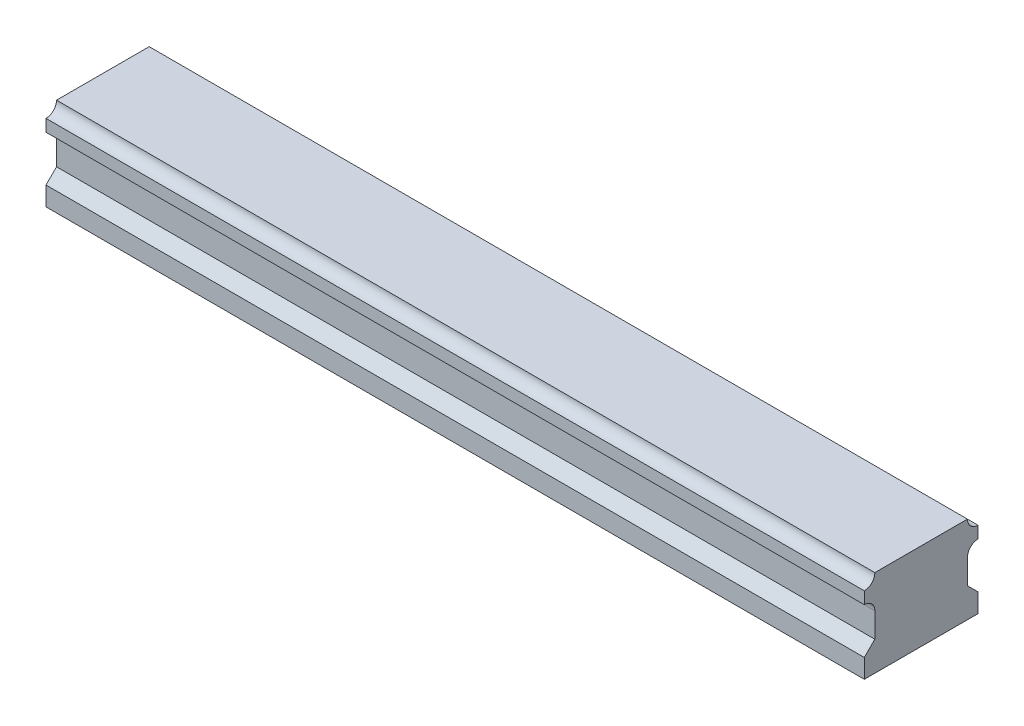
from build123d import *

# Parameters (mm, degrees)
BOSS_EXTRUDE1_DEPTH = 215.9


with BuildPart() as part:
    # Sketch1 → Boss-Extrude1 (new body)
    with BuildSketch(Plane(origin=(0, 0, 0), x_dir=(0, 0, -1), z_dir=(1, 0, 0))):
        with BuildLine():
            Line((0, 0), (30, 0))
            Line((30, 0), (30, 5))
            Line((30, 5), (27.221875, 7.778125))
            Line((27.221875, 7.778125), (27.221875, 14.278125))
            ThreePointArc((27.221875, 14.278125), (28.035568974, 16.242556026), (30, 17.05625))
            Line((30, 17.05625), (30, 20.221875))
            ThreePointArc((30, 20.221875), (28.035568974, 21.035568974), (27.221875, 23))
            Line((27.221875, 23), (2.778125, 23))
            ThreePointArc((2.778125, 23), (1.964431026, 21.035568974), (0, 20.221875))
            Line((0, 20.221875), (0, 17.05625))
            ThreePointArc((0, 17.05625), (1.964431026, 16.242556026), (2.778125, 14.278125))
            Line((2.778125, 14.278125), (2.778125, 7.778125))
            Line((2.778125, 7.778125), (0, 5))
            Line((0, 5), (0, 0))
        make_face()
    extrude(amount=BOSS_EXTRUDE1_DEPTH)


solid = part.part
